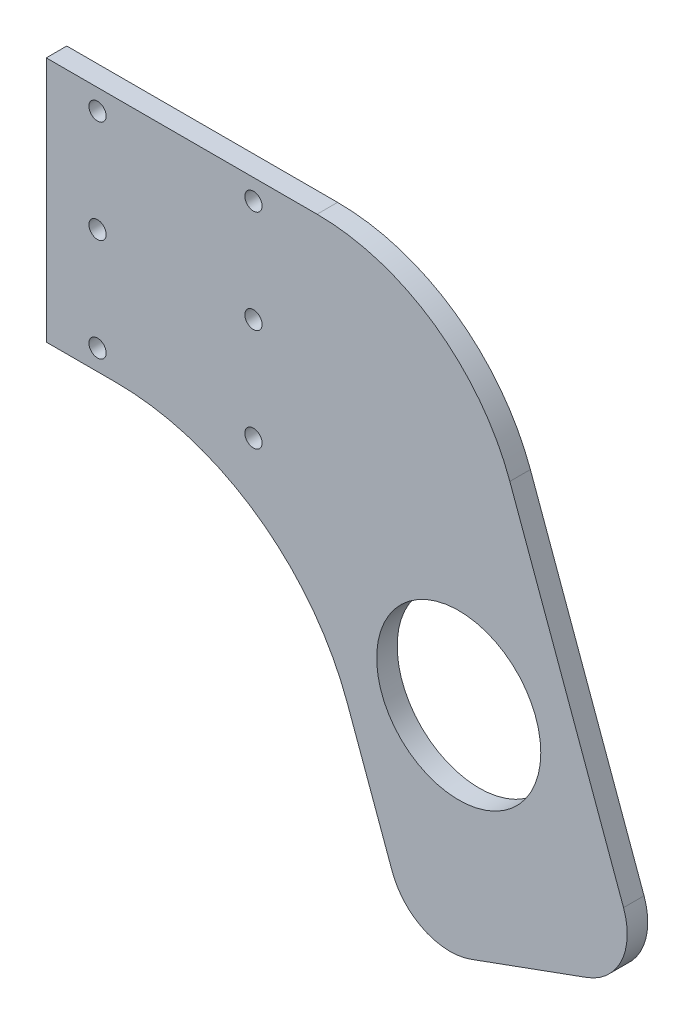
from build123d import *

# Parameters (mm, degrees)
SKETCH1_R           = 20
SKETCH1_R_2         = 2.1
BOSS_EXTRUDE1_DEPTH = 5
FILLET1_R           = 50
FILLET2_R           = 60
FILLET3_R           = 15


with BuildPart() as part:
    # Sketch1 → Boss-Extrude1 (new body)
    with BuildSketch(Plane.XY):
        Polygon((-80, 26.564623636), (-80, 86.564623636), (0, 86.564623636), (21.006226146, 86.564623636), (65.812994389, -36.540960351), (9.431437142, -57.06216895), (-21.006226146, 26.564623636), align=None)
        with Locations((20.5212086, 0.183066389)):
            Circle(SKETCH1_R, mode=Mode.SUBTRACT)
        with Locations((-67.5, 81.564623636)):
            Circle(SKETCH1_R_2, mode=Mode.SUBTRACT)
        with Locations((-67.5, 56.564623636)):
            Circle(SKETCH1_R_2, mode=Mode.SUBTRACT)
        with Locations((-67.5, 31.564623636)):
            Circle(SKETCH1_R_2, mode=Mode.SUBTRACT)
        with Locations((-29.5, 81.564623636)):
            Circle(SKETCH1_R_2, mode=Mode.SUBTRACT)
        with Locations((-29.5, 56.564623636)):
            Circle(SKETCH1_R_2, mode=Mode.SUBTRACT)
        with Locations((-29.5, 31.564623636)):
            Circle(SKETCH1_R_2, mode=Mode.SUBTRACT)
    extrude(amount=BOSS_EXTRUDE1_DEPTH)

    # Fillet1
    fillet1_edges = [part.edges().sort_by_distance(p)[0] for p in [
        (21.006226146, 86.564623636, 2.5),
    ]]
    fillet(fillet1_edges, radius=FILLET1_R)

    # Fillet2
    fillet2_edges = [part.edges().sort_by_distance(p)[0] for p in [
        (-21.006226146, 26.564623636, 2.5),
    ]]
    fillet(fillet2_edges, radius=FILLET2_R)

    # Fillet3
    fillet3_edges = [part.edges().sort_by_distance(p)[0] for p in [
        (65.812994389, -36.540960351, 2.5),
        (9.431437142, -57.06216895, 2.5),
    ]]
    fillet(fillet3_edges, radius=FILLET3_R)


solid = part.part
